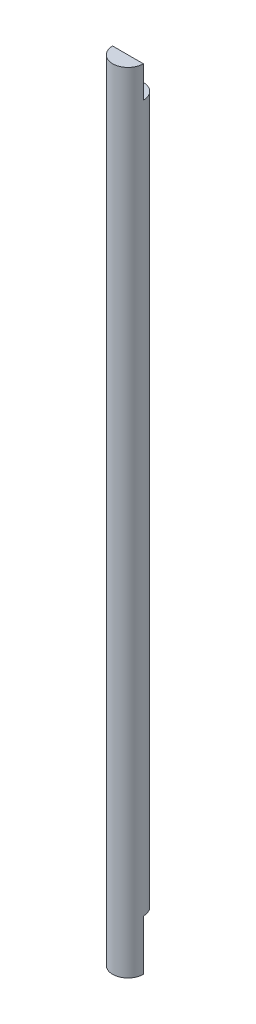
from build123d import *

# Parameters (mm, degrees)
SKETCH1_R           = 1.95
BOSS_EXTRUDE1_DEPTH = 50
SKETCH2_W           = 3.9
SKETCH2_H           = 4
SKETCH2_H_2         = 6.4
CUT_EXTRUDE1_DEPTH  = 51.075992252


with BuildPart() as part:
    # Sketch1 → Boss-Extrude1 (new, symmetric)
    with BuildSketch(Plane(origin=(0, 0, 0), x_dir=(1, 0, 0), z_dir=(0, 1, 0))):
        with Locations(Location((0, 0, 0), (0, 0, 270))):
            Circle(SKETCH1_R)
    extrude(amount=BOSS_EXTRUDE1_DEPTH, both=True)

    # Sketch2 → Cut-Extrude1 (cut, through all)
    with BuildSketch(Plane.XY):
        with Locations((0, 48)):
            Rectangle(SKETCH2_W, SKETCH2_H)
        with Locations((0, -46.8)):
            Rectangle(SKETCH2_W, SKETCH2_H_2)
    extrude(amount=-CUT_EXTRUDE1_DEPTH, mode=Mode.SUBTRACT)


solid = part.part
